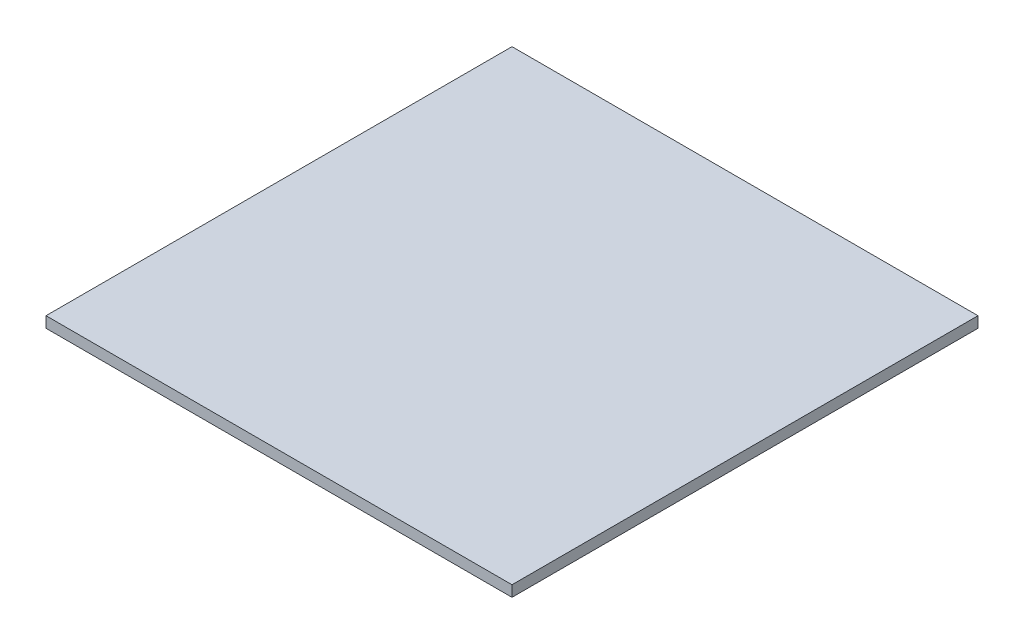
from build123d import *

# Parameters (mm, degrees)
SKETCH1_W           = 812.8
SKETCH1_H           = 812.8
BOSS_EXTRUDE1_DEPTH = 19.05


with BuildPart() as part:
    # Sketch1 → Boss-Extrude1 (new body)
    with BuildSketch(Plane(origin=(0, 0, 0), x_dir=(1, 0, 0), z_dir=(0, 1, 0))):
        with Locations((406.4, 406.4)):
            Rectangle(SKETCH1_W, SKETCH1_H)
    extrude(amount=BOSS_EXTRUDE1_DEPTH)


solid = part.part
